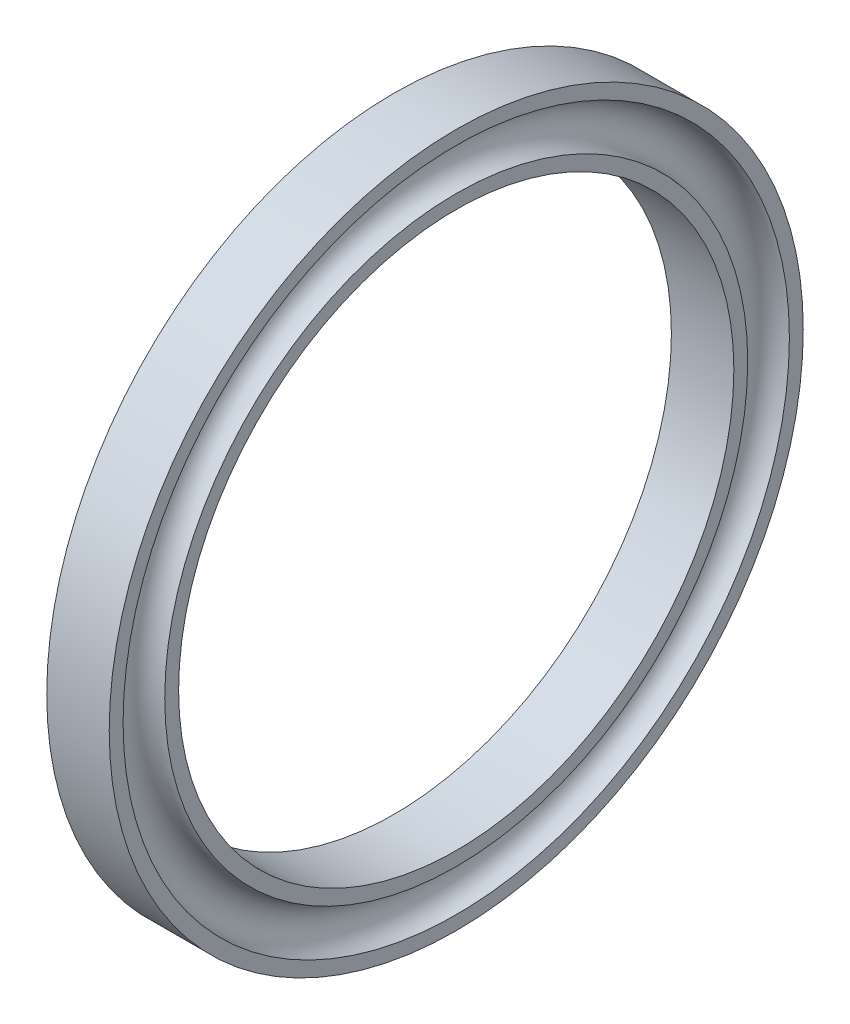
from build123d import *


with BuildPart() as part:
    # Szkic1 → Obrót1 (revolve)
    with BuildSketch(Plane.XY, mode=Mode.PRIVATE) as obr_t1_sk:
        with BuildLine():
            Line((-15.825105288, -45.893649888), (-20.325105288, -45.893649888))
            Line((-20.325105288, -45.893649888), (-20.325105288, -46.893649888))
            ThreePointArc((-20.325105288, -46.893649888), (-18.825105288, -48.393649888), (-20.325105288, -49.893649888))
            Line((-20.325105288, -49.893649888), (-20.325105288, -50.893649888))
            Line((-20.325105288, -50.893649888), (-15.825105288, -50.893649888))
            Line((-15.825105288, -50.893649888), (-15.825105288, -49.893649888))
            ThreePointArc((-15.825105288, -49.893649888), (-17.325105288, -48.393649888), (-15.825105288, -46.893649888))
            Line((-15.825105288, -46.893649888), (-15.825105288, -45.893649888))
        make_face()
    revolve(obr_t1_sk.sketch.rotate(Axis((19.531131842, -70.893649888, 0), (-1, 0, 0)), 90), axis=Axis((19.531131842, -70.893649888, 0), (-1, 0, 0)))


solid = part.part
